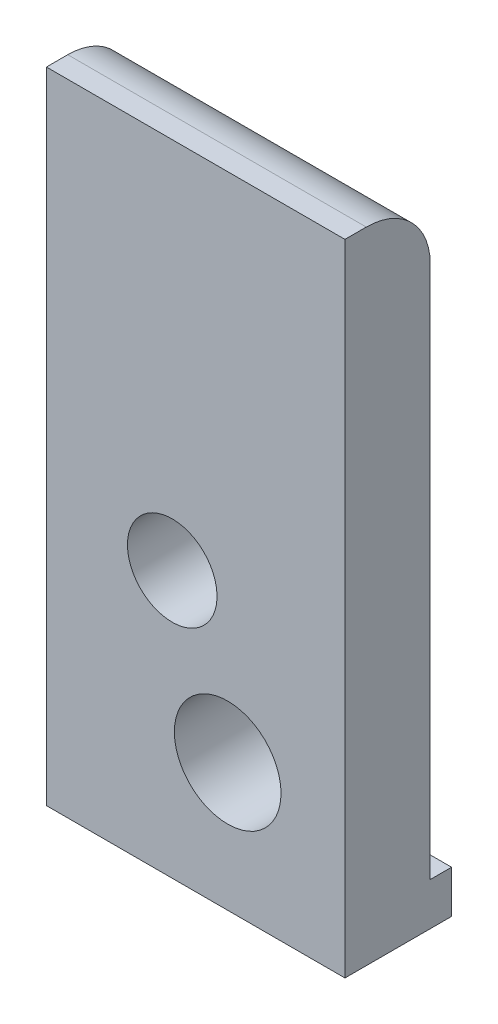
from build123d import *

# Parameters (mm, degrees)
ESQUISSE1_W                = 14
ESQUISSE1_H                = 30
BASE_EXTRUSION_DEPTH       = 5
ESQUISSE2_W                = 4
ESQUISSE2_H                = 29
ENL_V_MAT_EXTRU_2_DEPTH    = 34.481338086
CONG_2_R                   = 3
ENL_V_MAT_EXTRU_3_DEPTH    = 20
R_P_TITION_LIN_AIRE1_COUNT = 14
R_P_TITION_LIN_AIRE1_PITCH = 1
ESQUISSE10_W               = 2
ESQUISSE10_H               = 3
ENL_V_MAT_EXTRU_17_DEPTH   = 20
ESQUISSE11_W               = 2
ESQUISSE11_H               = 2
BOSS_EXTRU_2_DEPTH         = 14
ESQUISSE12_R               = 2.5
ENL_V_MAT_EXTRU_18_DEPTH   = 34.346664001
ESQUISSE13_R               = 2.1
ENL_V_MAT_EXTRU_19_DEPTH   = 14


with BuildPart() as part:
    # Esquisse1 → Base-Extrusion (new body)
    with BuildSketch(Plane.XY):
        with Locations((7, 15)):
            Rectangle(ESQUISSE1_W, ESQUISSE1_H)
    extrude(amount=BASE_EXTRUSION_DEPTH)

    # Esquisse2 → Enlèv. mat.-Extru.2 (cut, through all)
    with BuildSketch(Plane(origin=(14, 0, 0), x_dir=(0, 0, -1), z_dir=(1, 0, 0))):
        with Locations((-6, 16.5)):
            Rectangle(ESQUISSE2_W, ESQUISSE2_H)
    extrude(amount=-ENL_V_MAT_EXTRU_2_DEPTH, mode=Mode.SUBTRACT)

    # Congé2
    cong_2_edges = [part.edges().sort_by_distance(p)[0] for p in [
        (7, 30, 0),
    ]]
    fillet(cong_2_edges, radius=CONG_2_R)

    # Esquisse3 → Enlèv. mat.-Extru.3 (cut)
    with BuildSketch(Plane(origin=(0, 30, 0), x_dir=(-1, 0, 0), z_dir=(0, 1, 0))):
        Polygon((-13.9, 0), (-13.1, 0), (-13.5, 0.4), align=None)
    enl_v_mat_extru_3 = extrude(amount=-ENL_V_MAT_EXTRU_3_DEPTH, mode=Mode.SUBTRACT)

    # Répétition linéaire1: Enlèv. mat.-Extru.3 ×14
    with Locations(*[(-i * R_P_TITION_LIN_AIRE1_PITCH, 0, 0) for i in range(1, R_P_TITION_LIN_AIRE1_COUNT)]):
        add(enl_v_mat_extru_3, mode=Mode.SUBTRACT)

    # Esquisse10 → Enlèv. mat.-Extru.17 (cut)
    with BuildSketch(Plane.ZY):
        with Locations((5, 0.5)):
            Rectangle(ESQUISSE10_W, ESQUISSE10_H)
    extrude(amount=-ENL_V_MAT_EXTRU_17_DEPTH, mode=Mode.SUBTRACT)

    # Esquisse11 → Boss.-Extru.2 (add)
    with BuildSketch(Plane.ZY):
        with Locations((0, 1)):
            Rectangle(ESQUISSE11_W, ESQUISSE11_H)
    extrude(amount=-BOSS_EXTRU_2_DEPTH)

    # Esquisse12 → Enlèv. mat.-Extru.18 (cut, through all)
    with BuildSketch(Plane(origin=(0, 0, 0), x_dir=(-1, 0, 0), z_dir=(0, 0, -1))):
        with Locations((-8.5, 6)):
            Circle(ESQUISSE12_R)
    extrude(amount=-ENL_V_MAT_EXTRU_18_DEPTH, mode=Mode.SUBTRACT)

    # Esquisse13 → Enlèv. mat.-Extru.19 (cut)
    with BuildSketch(Plane(origin=(0, 0, 0), x_dir=(-1, 0, 0), z_dir=(0, 0, -1))):
        with Locations((-5.9, 12.5)):
            Circle(ESQUISSE13_R)
    extrude(amount=-ENL_V_MAT_EXTRU_19_DEPTH, mode=Mode.SUBTRACT)


solid = part.part
